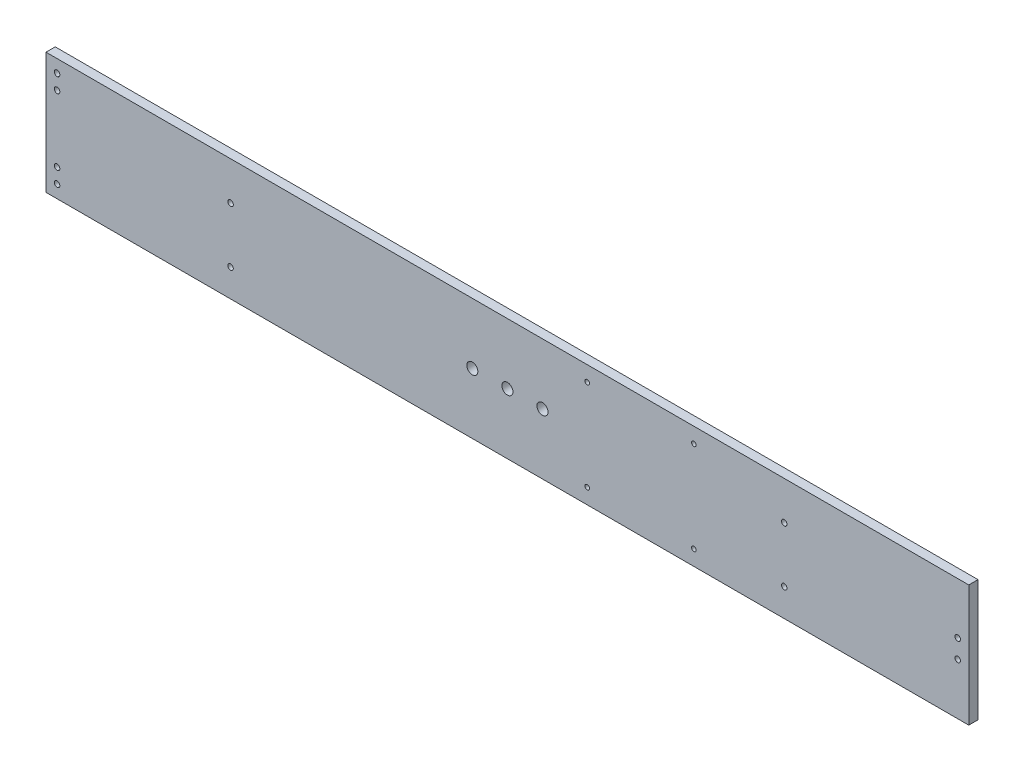
from build123d import *

# Parameters (mm, degrees)
SKETCH_3_W          = 500
SKETCH_3_H          = 65.8
SKETCH_3_R          = 1.25
SKETCH_3_R_2        = 3
EXTRUDE_2_DEPTH     = 5
SKETCH_4_R          = 1.5
CUT_EXTRUDE_1_DEPTH = 5
SKETCH_5_R          = 1.5
CUT_EXTRUDE_2_DEPTH = 5
SKETCH_6_R          = 3
CUT_EXTRUDE_3_DEPTH = 10


with BuildPart() as part:
    # 草图3 → 凸台-拉伸2 (new body)
    with BuildSketch(Plane.XY):
        Rectangle(SKETCH_3_W, SKETCH_3_H)
        with Locations((43.25, 24.65)):
            Circle(SKETCH_3_R, mode=Mode.SUBTRACT)
        with Locations((43.25, -24.65)):
            Circle(SKETCH_3_R, mode=Mode.SUBTRACT)
        with Locations((101.05, -24.65)):
            Circle(SKETCH_3_R, mode=Mode.SUBTRACT)
        with Locations((101.05, 24.65)):
            Circle(SKETCH_3_R, mode=Mode.SUBTRACT)
        Circle(SKETCH_3_R_2, mode=Mode.SUBTRACT)
    extrude(amount=EXTRUDE_2_DEPTH)

    # 草图4 → 切除-拉伸1 (cut)
    with BuildSketch(Plane.XY.offset(5)):
        with Locations((150, 12.1)):
            Circle(SKETCH_4_R)
        with Locations((150, -17.9)):
            Circle(SKETCH_4_R)
        with Locations(Location((-150, -17.9, 0), (0, 0, 180))):
            Circle(SKETCH_4_R)
        with Locations(Location((-150, 12.1, 0), (0, 0, 180))):
            Circle(SKETCH_4_R)
    extrude(amount=-CUT_EXTRUDE_1_DEPTH, mode=Mode.SUBTRACT)

    # 草图5 → 切除-拉伸2 (cut)
    with BuildSketch(Plane.XY.offset(5)):
        with Locations((-244, 26)):
            Circle(SKETCH_5_R)
        with Locations((244, -5)):
            Circle(SKETCH_5_R)
        with Locations((244, 5)):
            Circle(SKETCH_5_R)
        with Locations((-244, 18)):
            Circle(SKETCH_5_R)
        with Locations((-244, -18)):
            Circle(SKETCH_5_R)
        with Locations((-244, -26)):
            Circle(SKETCH_5_R)
    extrude(amount=-CUT_EXTRUDE_2_DEPTH, mode=Mode.SUBTRACT)

    # 草图6 → 切除-拉伸3 (cut)
    with BuildSketch(Plane.XY.offset(5)):
        with Locations((19, 0)):
            Circle(SKETCH_6_R)
        with Locations((-19, 0)):
            Circle(SKETCH_6_R)
    extrude(amount=-CUT_EXTRUDE_3_DEPTH, mode=Mode.SUBTRACT)


solid = part.part
